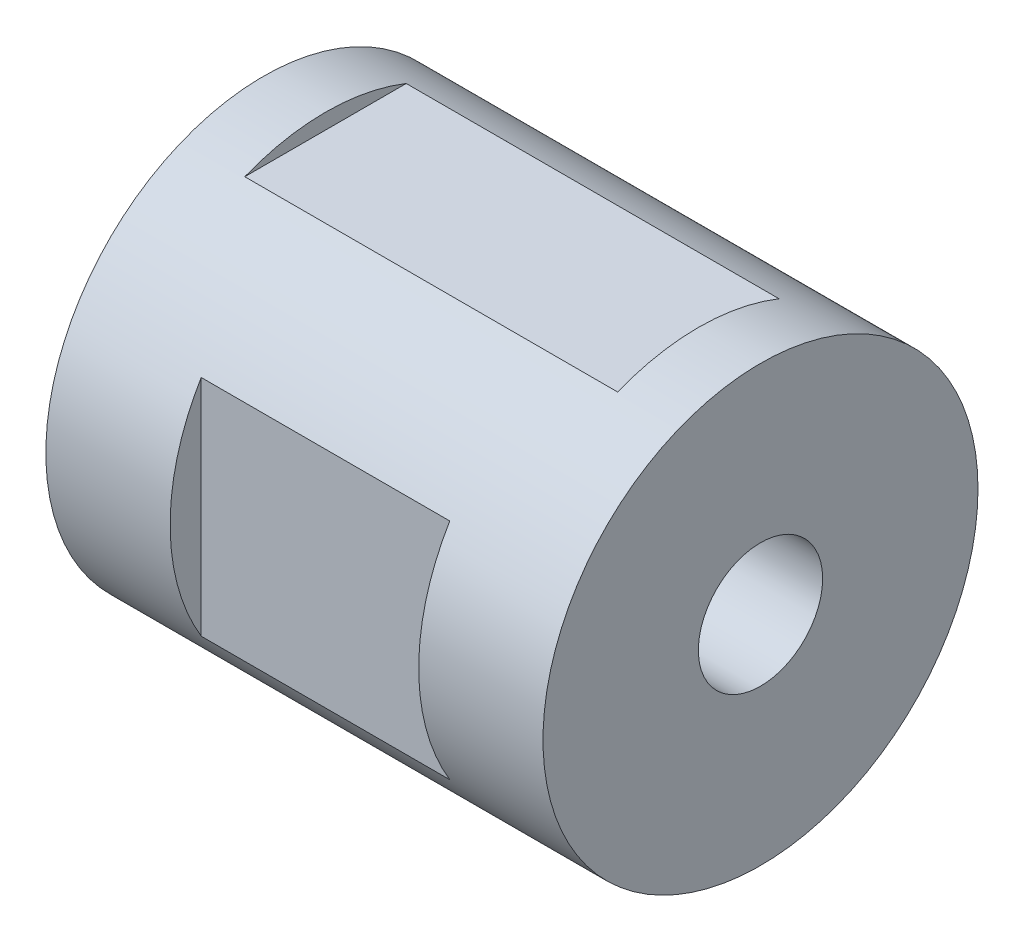
from build123d import *

# Parameters (mm, degrees)
SKETCH1_R           = 889
SKETCH1_R_2         = 254
BOSS_EXTRUDE1_DEPTH = 2032
SKETCH2_W           = 1016
SKETCH2_H           = 915.924
CUT_EXTRUDE1_DEPTH  = 127
SKETCH3_W           = 1524
SKETCH3_H           = 659.892
CUT_EXTRUDE2_DEPTH  = 63.5


with BuildPart() as part:
    # Sketch1 → Boss-Extrude1 (new body)
    with BuildSketch(Plane(origin=(0, 0, 0), x_dir=(0, 0, -1), z_dir=(1, 0, 0))):
        Circle(SKETCH1_R)
        Circle(SKETCH1_R_2, mode=Mode.SUBTRACT)
    extrude(amount=-BOSS_EXTRUDE1_DEPTH)

    # Sketch2 → Cut-Extrude1 (cut)
    with BuildSketch(Plane.XY.offset(889)):
        with Locations((-1016, 0)):
            Rectangle(SKETCH2_W, SKETCH2_H)
    extrude(amount=-CUT_EXTRUDE1_DEPTH, mode=Mode.SUBTRACT)

    # Sketch3 → Cut-Extrude2 (cut)
    with BuildSketch(Plane(origin=(0, 889, 0), x_dir=(1, 0, 0), z_dir=(0, 1, 0))):
        with Locations((-1016, 0)):
            Rectangle(SKETCH3_W, SKETCH3_H)
    extrude(amount=-CUT_EXTRUDE2_DEPTH, mode=Mode.SUBTRACT)


solid = part.part
